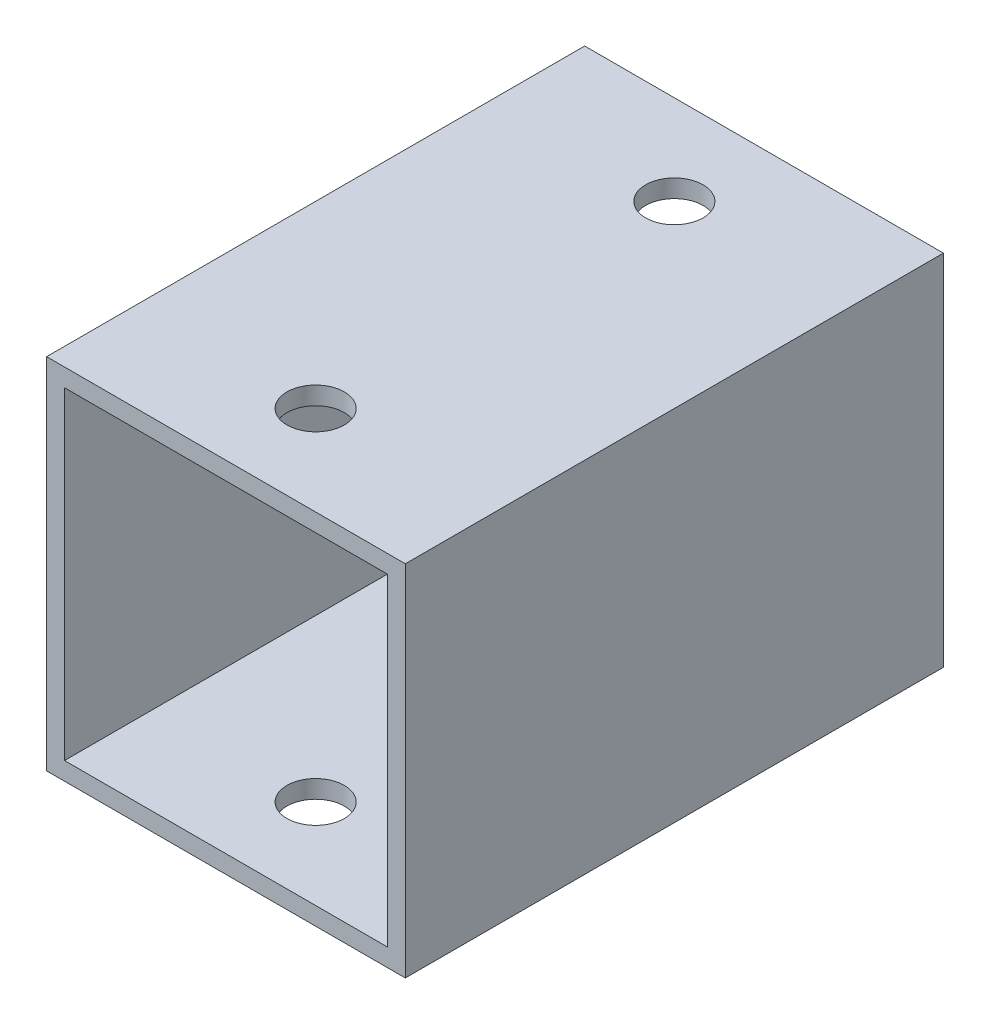
from build123d import *

# Parameters (mm, degrees)
SKETCH_1_W          = 20
SKETCH_1_H          = 20
SKETCH_1_W_2        = 18
SKETCH_1_H_2        = 18
EXTRUDE_1_DEPTH     = 30
SKETCH_2_R          = 1.6
CUT_EXTRUDE_1_DEPTH = 50


with BuildPart() as part:
    # 草图1 → 凸台-拉伸1 (new body)
    with BuildSketch(Plane.XY):
        Rectangle(SKETCH_1_W, SKETCH_1_H)
        Rectangle(SKETCH_1_W_2, SKETCH_1_H_2, mode=Mode.SUBTRACT)
    extrude(amount=EXTRUDE_1_DEPTH)

    # 草图2 → 切除-拉伸1 (cut)
    with BuildSketch(Plane(origin=(0, 10, 0), x_dir=(1, 0, 0), z_dir=(0, 1, 0))):
        with Locations(Location((0, -5, 0), (0, 0, 270))):
            Circle(SKETCH_2_R)
        with Locations(Location((0, -25, 0), (0, 0, 270))):
            Circle(SKETCH_2_R)
    extrude(amount=-CUT_EXTRUDE_1_DEPTH, mode=Mode.SUBTRACT)


solid = part.part
